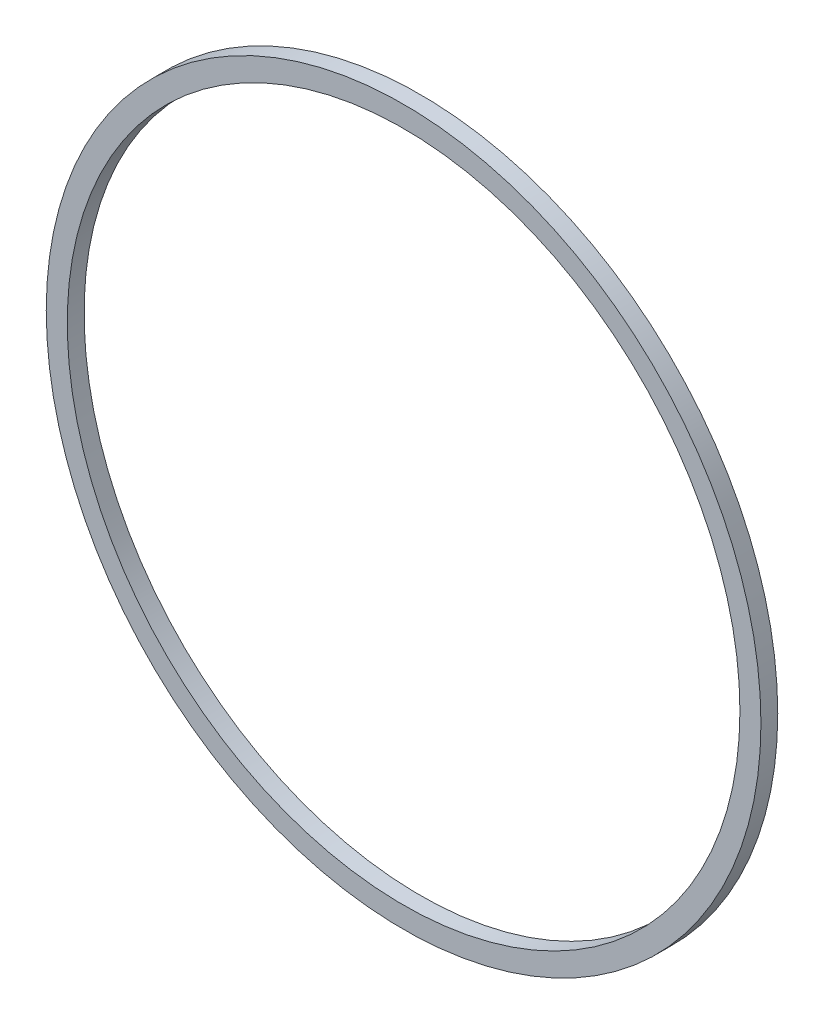
from build123d import *

# Parameters (mm, degrees)
SKETCH1_R           = 42.5
SKETCH1_R_2         = 40
BOSS_EXTRUDE1_DEPTH = 2


with BuildPart() as part:
    # Sketch1 → Boss-Extrude1 (new body)
    with BuildSketch(Plane.XY):
        Circle(SKETCH1_R)
        Circle(SKETCH1_R_2, mode=Mode.SUBTRACT)
    extrude(amount=BOSS_EXTRUDE1_DEPTH)


solid = part.part
